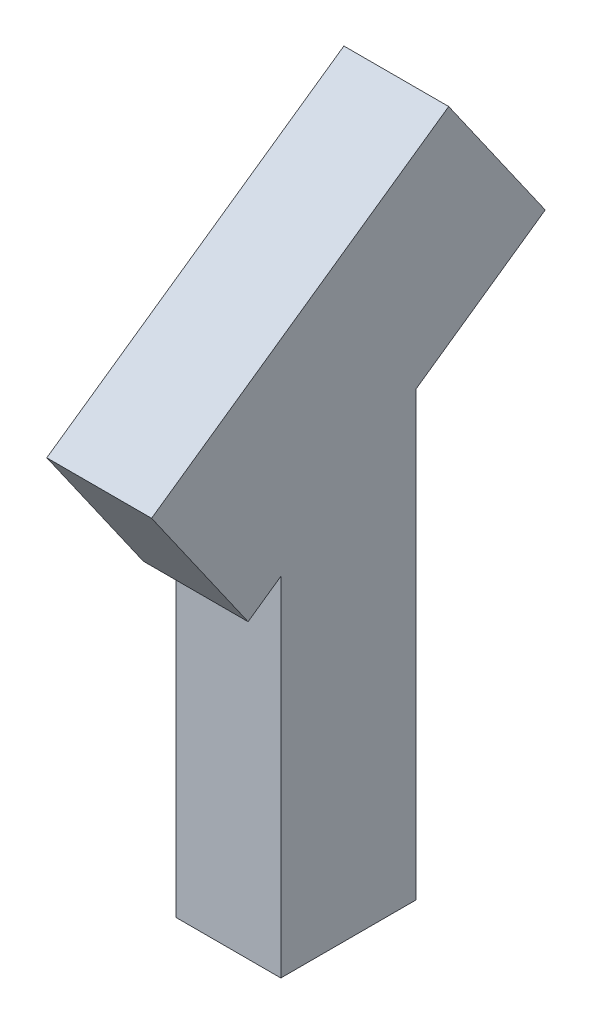
from build123d import *

# Parameters (mm, degrees)
BOSS_EXTRUDE3_DEPTH = 38


with BuildPart() as part:
    # Sketch1 → Boss-Extrude3 (new, symmetric)
    with BuildSketch(Plane(origin=(0, 0, 0), x_dir=(0, 0, -1), z_dir=(1, 0, 0))):
        Polygon((-49, 0), (49, 0), (49, 320.842919458), (142.706656441, 386.457026679), (72.730331207, 486.393576082), (-142.706656441, 335.542973321), (-72.730331207, 235.606423918), (-49, 252.222580713), align=None)
    extrude(amount=BOSS_EXTRUDE3_DEPTH, both=True)


solid = part.part
